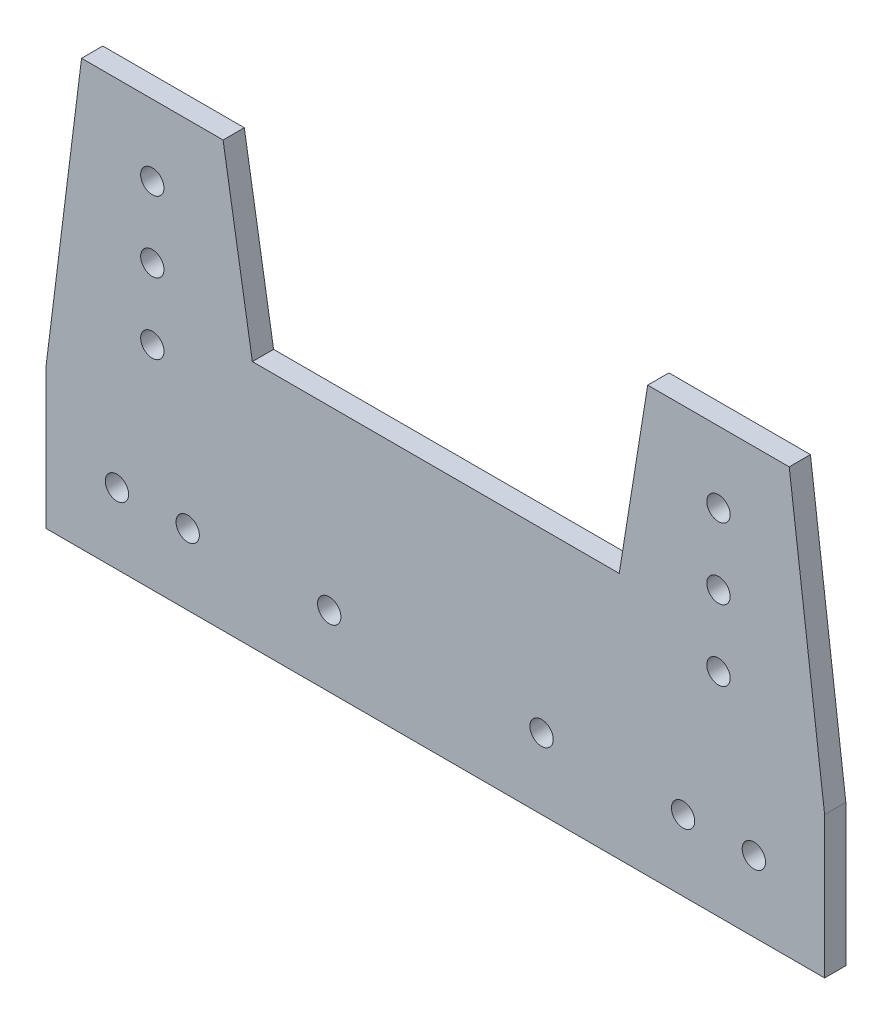
from build123d import *

# Parameters (mm, degrees)
SKETCH_1_R      = 1.65
EXTRUDE_1_DEPTH = 3


with BuildPart() as part:
    # 草图1 → 凸台-拉伸1 (new body)
    with BuildSketch(Plane.XY):
        Polygon((-55, 10), (-55, -10), (55, -10), (55, 10), (50, 50.05274288), (30, 50.05274288), (25.979309591, 25), (-25.864232627, 25), (-30, 50.05274288), (-50, 50.05274288), align=None)
        with Locations((15, 0)):
            Circle(SKETCH_1_R, mode=Mode.SUBTRACT)
        with Locations((-15, 0)):
            Circle(SKETCH_1_R, mode=Mode.SUBTRACT)
        with Locations((35, 0)):
            Circle(SKETCH_1_R, mode=Mode.SUBTRACT)
        with Locations((-35, 0)):
            Circle(SKETCH_1_R, mode=Mode.SUBTRACT)
        with Locations((45, 0)):
            Circle(SKETCH_1_R, mode=Mode.SUBTRACT)
        with Locations((-45, 0)):
            Circle(SKETCH_1_R, mode=Mode.SUBTRACT)
        with Locations((-40, 20)):
            Circle(SKETCH_1_R, mode=Mode.SUBTRACT)
        with Locations((-40, 30)):
            Circle(SKETCH_1_R, mode=Mode.SUBTRACT)
        with Locations((40, 20)):
            Circle(SKETCH_1_R, mode=Mode.SUBTRACT)
        with Locations((40, 30)):
            Circle(SKETCH_1_R, mode=Mode.SUBTRACT)
        with Locations((-40, 40)):
            Circle(SKETCH_1_R, mode=Mode.SUBTRACT)
        with Locations((40, 40)):
            Circle(SKETCH_1_R, mode=Mode.SUBTRACT)
    extrude(amount=EXTRUDE_1_DEPTH)


solid = part.part
